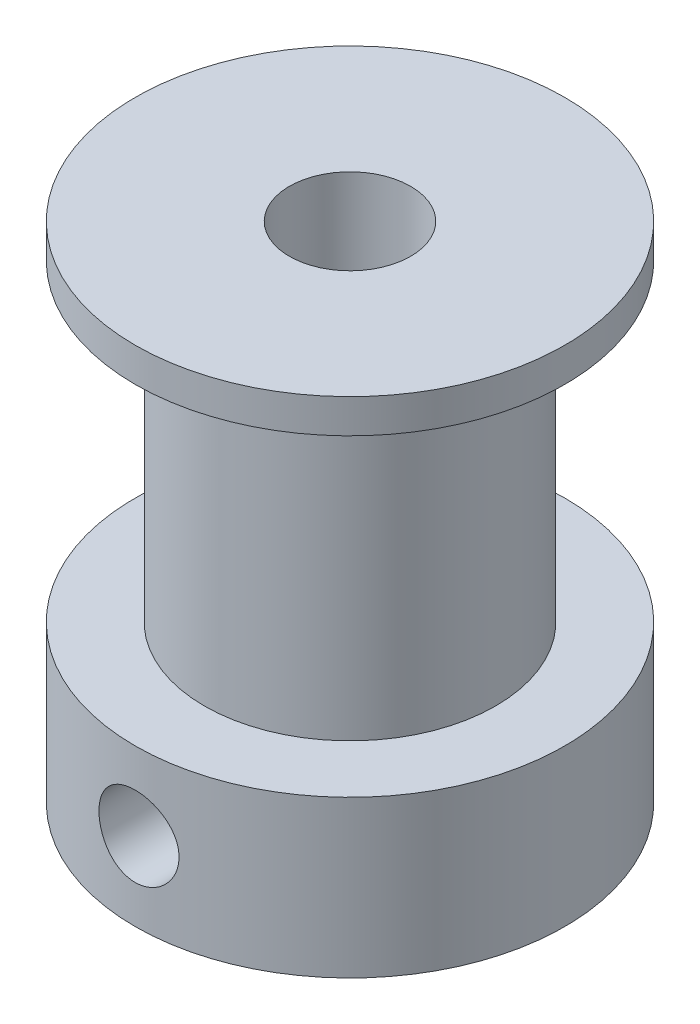
from build123d import *

# Parameters (mm, degrees)
CROQUIS3_W     = 1.65
CROQUIS3_H     = 8.851
MATRIZC1_COUNT = 2
MATRIZC1_ANGLE = 90


with BuildPart() as part:
    # Croquis1 → Revolución1 (revolve)
    with BuildSketch(Plane.XY, mode=Mode.PRIVATE) as revoluci_n1_sk:
        Polygon((8.85, 6.45), (8.85, 0), (2.5, 0), (2.5, 20.75), (8.85, 20.75), (8.85, 19.35), (6, 19.35), (6, 6.45), align=None)
    revolve(revoluci_n1_sk.sketch.rotate(Axis((0, 0, 0), (0, 1, 0)), 90), axis=Axis((0, 0, 0), (0, 1, 0)))

    # Croquis3 → Taladro roscado M41 (revolve, cut)
    with BuildSketch(Plane(origin=(0, 3.225, 0), x_dir=(0, 1, 0), z_dir=(1, 0, 0))):
        with Locations((0.825, 4.4255)):
            Rectangle(CROQUIS3_W, CROQUIS3_H)
    taladro_roscado_m41 = revolve(axis=Axis((0, 3.225, -6.35), (0, 0, 1)), mode=Mode.SUBTRACT)

    # MatrizC1: Taladro roscado M41 ×2 about axis
    matrizc1_axis = Axis((0, 0, 0), (0, -1, 0))
    for i in range(1, MATRIZC1_COUNT):
        add(taladro_roscado_m41.rotate(matrizc1_axis, i * MATRIZC1_ANGLE / (MATRIZC1_COUNT - 1)), mode=Mode.SUBTRACT)


solid = part.part
